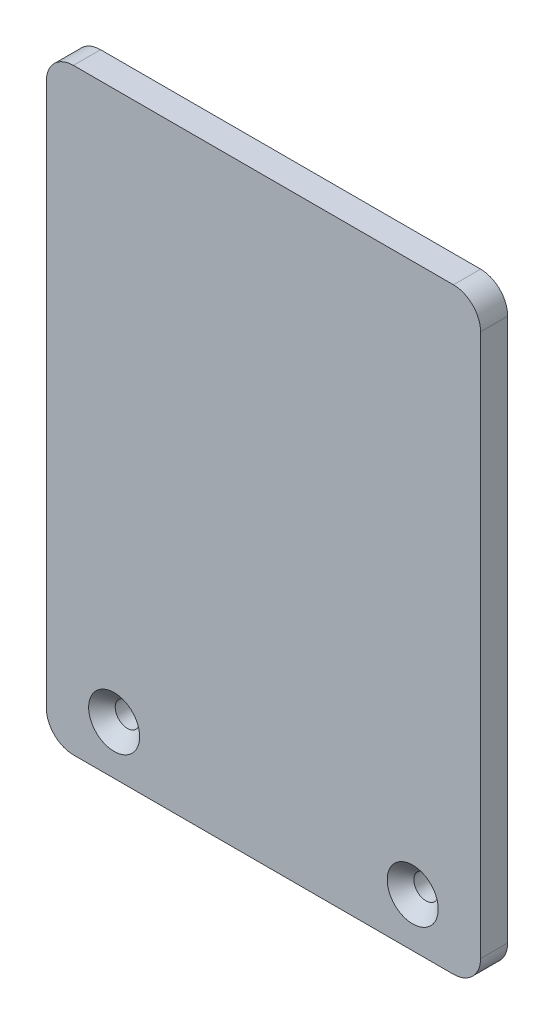
from build123d import *

# Parameters (mm, degrees)
SKETCH1_W                                           = 80
SKETCH1_H                                           = 110
BOSS_EXTRUDE1_DEPTH                                 = 5
FILLET1_R                                           = 5
CSK_FOR_M4_COUNTERSUNK_FLAT_HEAD_SCREW1_D           = 4.5
CSK_FOR_M4_COUNTERSUNK_FLAT_HEAD_SCREW1_DEPTH       = 10
CSK_FOR_M4_COUNTERSUNK_FLAT_HEAD_SCREW1_CSINK_D     = 9.4
CSK_FOR_M4_COUNTERSUNK_FLAT_HEAD_SCREW1_CSINK_ANGLE = 90
CSK_FOR_M4_COUNTERSUNK_FLAT_HEAD_SCREW1_TIP         = 1.351936393


with BuildPart() as part:
    # Sketch1 → Boss-Extrude1 (new body)
    with BuildSketch(Plane.XY):
        with Locations((0, 55)):
            Rectangle(SKETCH1_W, SKETCH1_H)
    extrude(amount=BOSS_EXTRUDE1_DEPTH)

    # Fillet1
    fillet1_edges = [part.edges().sort_by_distance(p)[0] for p in [
        (-40, 110, 2.5),
        (40, 110, 2.5),
        (40, 0, 2.5),
        (-40, 0, 2.5),
    ]]
    fillet(fillet1_edges, radius=FILLET1_R)

    # CSK for M4 Countersunk Flat Head Screw1
    with Locations(Plane.XY.offset(5)):
        with Locations((-27.5, 9), (27.5, 8.987365755)):
            CounterSinkHole(CSK_FOR_M4_COUNTERSUNK_FLAT_HEAD_SCREW1_D / 2, CSK_FOR_M4_COUNTERSUNK_FLAT_HEAD_SCREW1_CSINK_D / 2, depth=CSK_FOR_M4_COUNTERSUNK_FLAT_HEAD_SCREW1_DEPTH, counter_sink_angle=CSK_FOR_M4_COUNTERSUNK_FLAT_HEAD_SCREW1_CSINK_ANGLE)
            with Locations((0, 0, -(CSK_FOR_M4_COUNTERSUNK_FLAT_HEAD_SCREW1_DEPTH + CSK_FOR_M4_COUNTERSUNK_FLAT_HEAD_SCREW1_TIP / 2))):  # 118° drill point
                Cone(0, CSK_FOR_M4_COUNTERSUNK_FLAT_HEAD_SCREW1_D / 2, CSK_FOR_M4_COUNTERSUNK_FLAT_HEAD_SCREW1_TIP, mode=Mode.SUBTRACT)


solid = part.part
